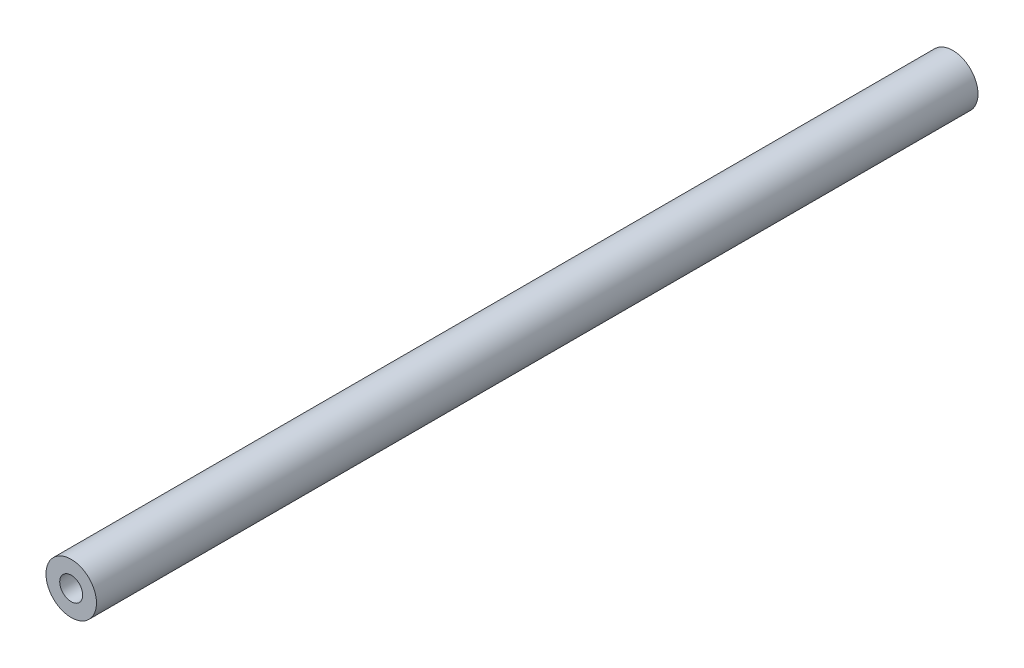
from build123d import *

# Parameters (mm, degrees)
SKETCH1_R           = 2.75
SKETCH1_R_2         = 1.25
BOSS_EXTRUDE1_DEPTH = 96


with BuildPart() as part:
    # Sketch1 → Boss-Extrude1 (new body)
    with BuildSketch(Plane.XY):
        Circle(SKETCH1_R)
        Circle(SKETCH1_R_2, mode=Mode.SUBTRACT)
    extrude(amount=BOSS_EXTRUDE1_DEPTH)


solid = part.part
